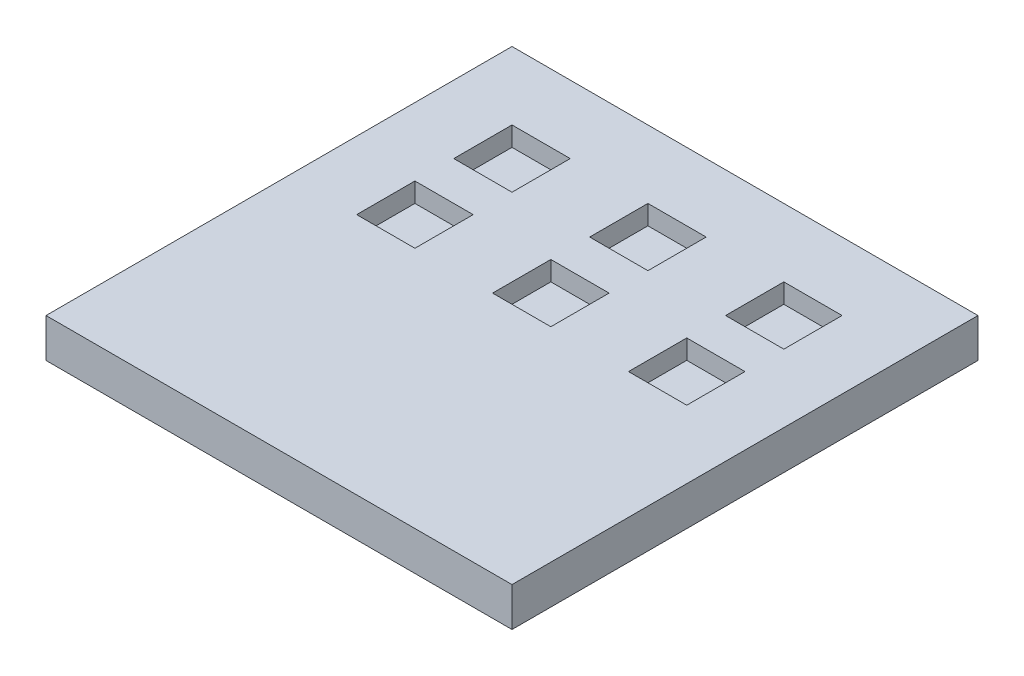
from build123d import *

# Parameters (mm, degrees)
SKETCH1_W            = 304.8
SKETCH1_H            = 304.8
BOSS_EXTRUDE1_DEPTH  = 25.471786057
SKETCH2_W            = 38.1
SKETCH2_H            = 38.1
CUT_EXTRUDE1_DEPTH   = 12.7
LPATTERN1_COUNT      = 2
LPATTERN1_PITCH      = 63.5
LPATTERN1_COUNT_DIR2 = 3
LPATTERN1_PITCH_DIR2 = 88.9


with BuildPart() as part:
    # Sketch1 → Boss-Extrude1 (new body)
    with BuildSketch(Plane(origin=(0, 0, 0), x_dir=(1, 0, 0), z_dir=(0, 1, 0))):
        Rectangle(SKETCH1_W, SKETCH1_H)
    extrude(amount=BOSS_EXTRUDE1_DEPTH)

    # Sketch2 → Cut-Extrude1 (cut)
    with BuildSketch(Plane(origin=(0, 25.471786057, 0), x_dir=(1, 0, 0), z_dir=(0, 1, 0))):
        with Locations((-88.9, 88.9)):
            Rectangle(SKETCH2_W, SKETCH2_H)
    cut_extrude1 = extrude(amount=-CUT_EXTRUDE1_DEPTH, mode=Mode.SUBTRACT)

    # LPattern1: Cut-Extrude1 2 × 3
    with Locations(*[(j * LPATTERN1_PITCH_DIR2, 0, i * LPATTERN1_PITCH) for i in range(LPATTERN1_COUNT) for j in range(LPATTERN1_COUNT_DIR2) if (i, j) != (0, 0)]):
        add(cut_extrude1, mode=Mode.SUBTRACT)


solid = part.part
